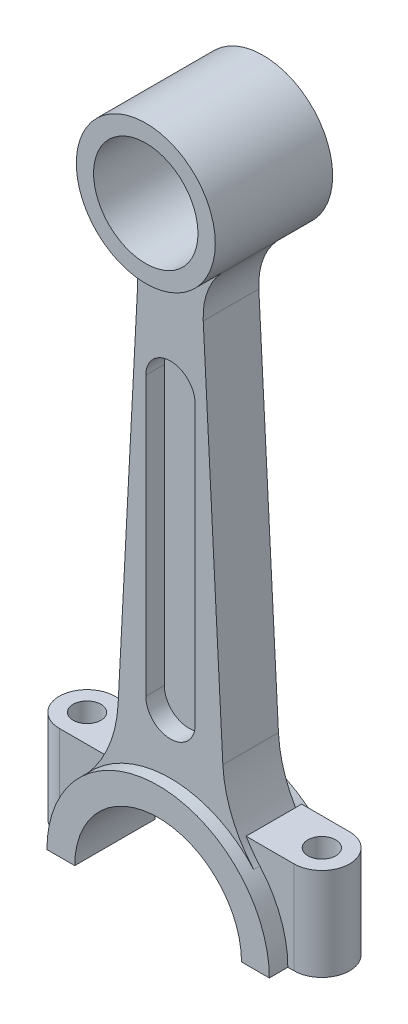
from build123d import *

# Parameters (mm, degrees)
SKETCH1_R                = 22.5
SKETCH1_R_2              = 16.9
BOSS_EXTRUDE1_DEPTH      = 19
BOSS_EXTRUDE2_DEPTH      = 11
BOSS_EXTRUDE2_DEPTH_BACK = 7
BOSS_EXTRUDE3_DEPTH      = 15
BOSS_EXTRUDE3_DEPTH_BACK = 11
BOSS_EXTRUDE4_DEPTH      = 9
FILLET1_RADIUS           = 9
FILLET1_LENGTH           = 30
FILLET2_RADIUS           = 9
FILLET2_LENGTH           = 30
SKETCH2_R                = 4.5
CUT_EXTRUDE1_DEPTH       = 78
FILLET5_R                = 22.5
BOSS_EXTRUDE5_DEPTH      = 5


with BuildPart() as part:
    # Sketch1 → Boss-Extrude1 (new, symmetric)
    with BuildSketch(Plane.XY):
        with Locations((0, 201.2)):
            Circle(SKETCH1_R)
        with Locations((0, 201.2)):
            Circle(SKETCH1_R_2, mode=Mode.SUBTRACT)
    extrude(amount=BOSS_EXTRUDE1_DEPTH, both=True)

    # Sketch1<3> → Boss-Extrude2 (add, two sides: drawn at the far end of the back side and taken through both)
    with BuildSketch(Plane.XY.offset(-BOSS_EXTRUDE2_DEPTH_BACK)):
        with BuildLine():
            ThreePointArc((-22.483530605, 30), (-24.572828472, 26.825646402), (-26.953938029, 23.863889556))
            ThreePointArc((-26.953938029, 23.863889556), (0, 36), (26.953938029, 23.863889556))
            ThreePointArc((26.953938029, 23.863889556), (24.572828472, 26.825646402), (22.483530605, 30))
            ThreePointArc((22.483530605, 30), (18.612945898, 38.808225452), (16.957576671, 48.285884145))
            Line((16.957576671, 48.285884145), (10, 181.044355629))
            ThreePointArc((10, 181.044355629), (0, 178.7), (-10, 181.044355629))
            Line((-10, 181.044355629), (-16.957576671, 48.285884145))
            ThreePointArc((-16.957576671, 48.285884145), (-18.612945898, 38.808225452), (-22.483530605, 30))
        make_face()
        with BuildLine():
            ThreePointArc((-8, 145), (0, 153), (8, 145))
            Line((8, 145), (8, 55))
            ThreePointArc((8, 55), (0, 47), (-8, 55))
            Line((-8, 55), (-8, 145))
        make_face(mode=Mode.SUBTRACT)
    extrude(amount=BOSS_EXTRUDE2_DEPTH + BOSS_EXTRUDE2_DEPTH_BACK)

    # Sketch1<4> → Boss-Extrude3 (add, two sides: drawn at the far end of the back side and taken through both)
    with BuildSketch(Plane.XY.offset(-BOSS_EXTRUDE3_DEPTH_BACK)):
        with BuildLine():
            ThreePointArc((-26.953938029, 23.863889556), (-33.66260365, 12.760451225), (-36, 0))
            Line((-36, 0), (-27, 0))
            ThreePointArc((-27, 0), (0, 27), (27, 0))
            Line((27, 0), (36, 0))
            ThreePointArc((36, 0), (33.66260365, 12.760451225), (26.953938029, 23.863889556))
            ThreePointArc((26.953938029, 23.863889556), (0, 36), (-26.953938029, 23.863889556))
        make_face()
    extrude(amount=BOSS_EXTRUDE3_DEPTH + BOSS_EXTRUDE3_DEPTH_BACK)

    # Sketch1<6> → Boss-Extrude4 (add, symmetric)
    with BuildSketch(Plane.XY):
        with BuildLine():
            Line((-47, 0), (-36, 0))
            ThreePointArc((-36, 0), (-33.66260365, 12.760451225), (-26.953938029, 23.863889556))
            ThreePointArc((-26.953938029, 23.863889556), (-24.572828472, 26.825646402), (-22.483530605, 30))
            Line((-22.483530605, 30), (-47, 30))
            Line((-47, 30), (-47, 0))
        make_face()
        with BuildLine():
            ThreePointArc((22.483530605, 30), (24.572828472, 26.825646402), (26.953938029, 23.863889556))
            ThreePointArc((26.953938029, 23.863889556), (33.66260365, 12.760451225), (36, 0))
            Line((36, 0), (47, 0))
            Line((47, 0), (47, 30))
            Line((47, 30), (22.483530605, 30))
        make_face()
    extrude(amount=BOSS_EXTRUDE4_DEPTH, both=True)

    # Fillet1: full round fillet: the end face becomes a half cylinder, R = half its width
    fillet1_face = Plane((47, 15, 0), x_dir=(0, 1, 0), z_dir=(1, 0, 0))  # on the end face: x along it, z out of the body
    fillet1_slab = fillet1_face.offset(-FILLET1_RADIUS / 2) * Box(FILLET1_LENGTH, 2 * FILLET1_RADIUS, FILLET1_RADIUS, mode=Mode.PRIVATE)  # the body's end, R deep
    fillet1_round = Plane((38, 15, 0), x_dir=(1, 0, 0), z_dir=(0, 1, 0)) * Cylinder(FILLET1_RADIUS, FILLET1_LENGTH, mode=Mode.PRIVATE)  # its axis R under the face
    add(fillet1_slab - fillet1_round, mode=Mode.SUBTRACT)

    # Fillet2: full round fillet: the end face becomes a half cylinder, R = half its width
    fillet2_face = Plane((-47, 15, 0), x_dir=(0, 1, 0), z_dir=(-1, 0, 0))  # on the end face: x along it, z out of the body
    fillet2_slab = fillet2_face.offset(-FILLET2_RADIUS / 2) * Box(FILLET2_LENGTH, 2 * FILLET2_RADIUS, FILLET2_RADIUS, mode=Mode.PRIVATE)  # the body's end, R deep
    fillet2_round = Plane((-38, 15, 0), x_dir=(-1, 0, 0), z_dir=(0, 1, 0)) * Cylinder(FILLET2_RADIUS, FILLET2_LENGTH, mode=Mode.PRIVATE)  # its axis R under the face
    add(fillet2_slab - fillet2_round, mode=Mode.SUBTRACT)

    # Sketch2 → Cut-Extrude1 (cut)
    with BuildSketch(Plane(origin=(0, 30, 0), x_dir=(1, 0, 0), z_dir=(0, 1, 0))):
        with Locations(Location((38, 0, 0), (0, 0, 270))):
            Circle(SKETCH2_R)
        with Locations(Location((-38, 0, 0), (0, 0, 270))):
            Circle(SKETCH2_R)
    extrude(amount=-CUT_EXTRUDE1_DEPTH, mode=Mode.SUBTRACT)

    # Fillet5
    fillet5_edges = [part.edges().sort_by_distance(p)[0] for p in [
        (-10, 181.044355629, 2),
        (10, 181.044355629, 2),
    ]]
    fillet(fillet5_edges, radius=FILLET5_R)

    # Sketch1<7> → Boss-Extrude5 (add, symmetric)
    with BuildSketch(Plane.XY):
        with BuildLine():
            Line((-8, 145), (-8, 55))
            ThreePointArc((-8, 55), (0, 47), (8, 55))
            Line((8, 55), (8, 145))
            ThreePointArc((8, 145), (0, 153), (-8, 145))
        make_face()
    extrude(amount=BOSS_EXTRUDE5_DEPTH, both=True)


solid = part.part
